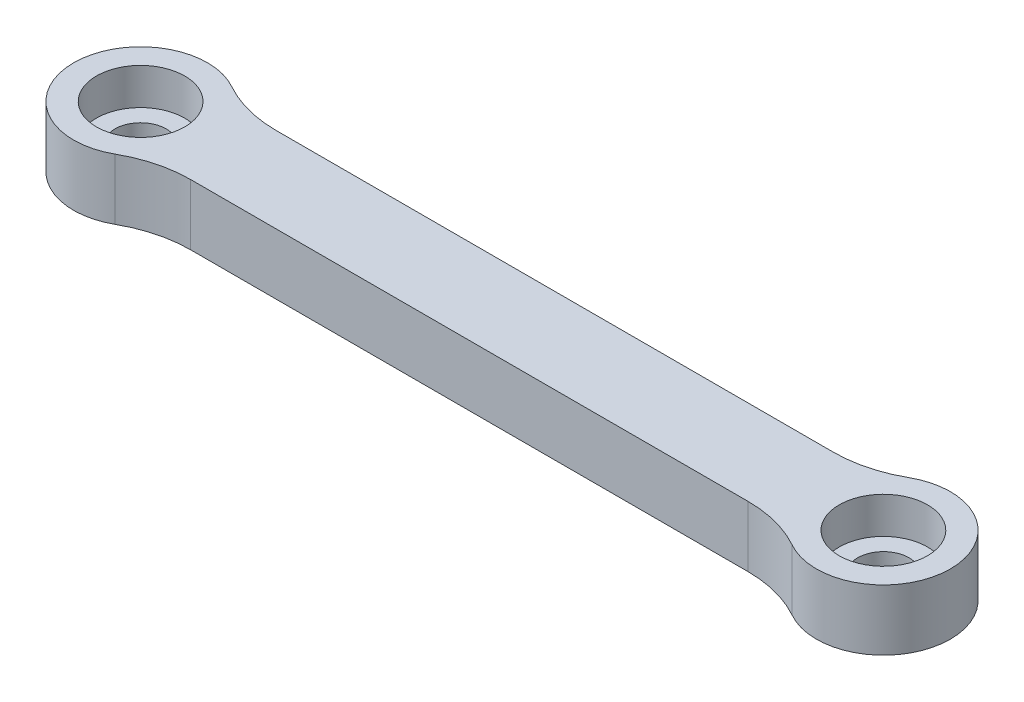
from build123d import *

# Parameters (mm, degrees)
SKETCH1_R           = 2.1
BOSS_EXTRUDE1_DEPTH = 5
SKETCH2_R           = 3.625
CUT_EXTRUDE1_DEPTH  = 3
FILLET1_R           = 10


with BuildPart() as part:
    # Sketch1 → Boss-Extrude1 (new body)
    with BuildSketch(Plane(origin=(0, 0, 0), x_dir=(1, 0, 0), z_dir=(0, 1, 0))):
        with BuildLine():
            Line((-56.757359313, -3.5), (-4.242640687, -3.5))
            ThreePointArc((-4.242640687, -3.5), (5.5, 0), (-4.242640687, 3.5))
            Line((-4.242640687, 3.5), (-56.757359313, 3.5))
            ThreePointArc((-56.757359313, 3.5), (-66.5, 0), (-56.757359313, -3.5))
        make_face()
        with Locations(Location((-61, 0, 0), (0, 0, 270))):
            Circle(SKETCH1_R, mode=Mode.SUBTRACT)
        with Locations(Location((0, 0, 0), (0, 0, 90))):
            Circle(SKETCH1_R, mode=Mode.SUBTRACT)
    extrude(amount=BOSS_EXTRUDE1_DEPTH)

    # Sketch2 → Cut-Extrude1 (cut)
    with BuildSketch(Plane(origin=(0, 5, 0), x_dir=(1, 0, 0), z_dir=(0, 1, 0))):
        with Locations(Location((-61, 0, 0), (0, 0, 270))):
            Circle(SKETCH2_R)
        with Locations(Location((0, 0, 0), (0, 0, 270))):
            Circle(SKETCH2_R)
    extrude(amount=-CUT_EXTRUDE1_DEPTH, mode=Mode.SUBTRACT)

    # Fillet1
    fillet1_edges = [part.edges().sort_by_distance(p)[0] for p in [
        (-4.242640687, 2.5, 3.5),
        (-56.757359313, 2.5, 3.5),
        (-56.757359313, 2.5, -3.5),
        (-4.242640687, 2.5, -3.5),
    ]]
    fillet(fillet1_edges, radius=FILLET1_R)


solid = part.part
